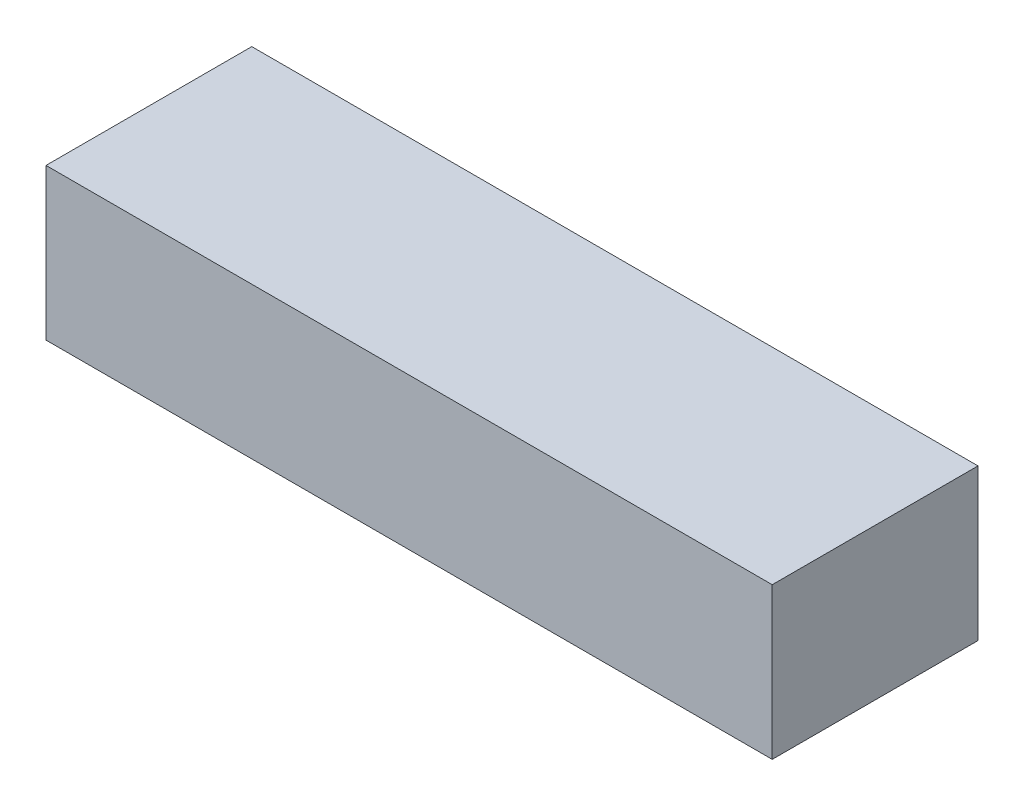
from build123d import *

# Parameters (mm, degrees)
SKETCH1_W           = 120
SKETCH1_H           = 34
BOSS_EXTRUDE1_DEPTH = 25
BOSS_EXTRUDE2_DEPTH = 2


with BuildPart() as part:
    # Sketch1 → Boss-Extrude1 (new body)
    with BuildSketch(Plane(origin=(0, 0, 0), x_dir=(1, 0, 0), z_dir=(0, 1, 0))):
        Rectangle(SKETCH1_W, SKETCH1_H)
    extrude(amount=BOSS_EXTRUDE1_DEPTH)

    # Sketch2 → Boss-Extrude2 (add)
    with BuildSketch(Plane.ZY.offset(60)):
        Polygon((8.280528472, 10.841133841), (5.608754496, 18.760489421), (-2.585495606, 20.406343074), (-8.107971731, 14.132841147), (-5.436197754, 6.213485568), (2.758052347, 4.567631915), align=None)
    extrude(amount=BOSS_EXTRUDE2_DEPTH)


solid = part.part
